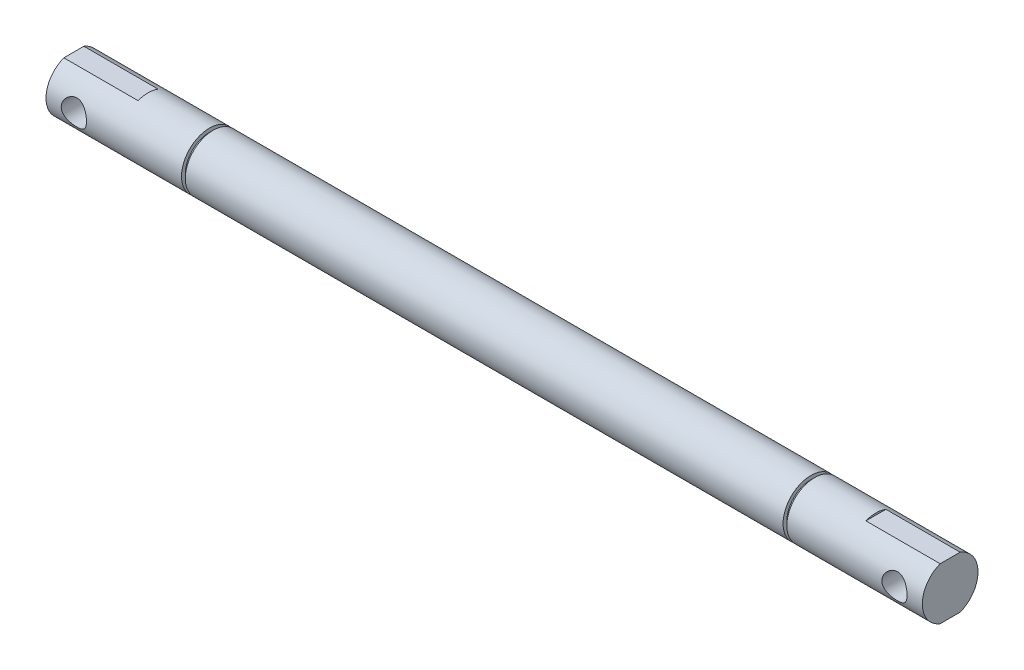
from build123d import *

# Parameters (mm, degrees)
IZIM1_R                     = 7.5
Y_KSEKLIK_EKSTR_ZYON1_DEPTH = 118
IZIM2_W                     = 1
IZIM2_H                     = 2
KES_EKSTR_ZYON1_DEPTH       = 20
M8_DI_LI_DELIK1_D           = 6.8
AYNALAMA3_COPY_1_DEPTH      = 20


with BuildPart() as part:
    # Çizim1 → Yükseklik-Ekstrüzyon1 (new, symmetric)
    with BuildSketch(Plane(origin=(0, 0, 0), x_dir=(0, 0, -1), z_dir=(1, 0, 0))):
        Circle(IZIM1_R)
    extrude(amount=Y_KSEKLIK_EKSTR_ZYON1_DEPTH, both=True)

    # Çizim2 → Kes-Döndür2 (revolve, cut)
    with BuildSketch(Plane.XY, mode=Mode.PRIVATE) as kes_d_nd_r2_sk:
        with Locations((-81, 7.5)):
            Rectangle(IZIM2_W, IZIM2_H)
    kes_d_nd_r2 = revolve(kes_d_nd_r2_sk.sketch.rotate(Axis((0, 0, 0), (-1, 0, 0)), 90), axis=Axis((0, 0, 0), (-1, 0, 0)), mode=Mode.SUBTRACT)

    # Çizim3 → Kes-Ekstrüzyon1 (cut)
    with BuildSketch(Plane.ZY.offset(118)):
        Polygon((5.217035769, 7), (-5.217035769, 7), (-0.675959806, 12.212790329), align=None)
    kes_ekstr_zyon1 = extrude(amount=-KES_EKSTR_ZYON1_DEPTH, mode=Mode.SUBTRACT)

    # Aynalama2: Kes-Ekstrüzyon1 across plane
    add(kes_ekstr_zyon1.mirror(Plane.ZX), mode=Mode.SUBTRACT)

    # M8 Dişli Delik1 (through all)
    with Locations(Plane.XY.offset(12)):
        with Locations((-110.5, 0)):
            m8_di_li_delik1 = Hole(M8_DI_LI_DELIK1_D / 2)

    # Aynalama3: Kes-Döndür2, Kes-Ekstrüzyon1, M8 Dişli Delik1 across plane
    add(kes_d_nd_r2.mirror(Plane(origin=(0, 0, 0), x_dir=(0, 0, 1), z_dir=(1, 0, 0))), mode=Mode.SUBTRACT)
    add(kes_ekstr_zyon1.mirror(Plane(origin=(0, 0, 0), x_dir=(0, 0, 1), z_dir=(1, 0, 0))), mode=Mode.SUBTRACT)
    add(m8_di_li_delik1.mirror(Plane(origin=(0, 0, 0), x_dir=(0, 0, 1), z_dir=(1, 0, 0))), mode=Mode.SUBTRACT)

    # Aynalama3 copy 1 sketch → Aynalama3 copy 1 (cut)
    with BuildSketch(Plane(origin=(118, 0, 0), x_dir=(0, 0, 1), z_dir=(1, 0, 0))):
        Polygon((5.217035769, 7), (-5.217035769, 7), (-0.675959806, 12.212790329), align=None)
    extrude(amount=-AYNALAMA3_COPY_1_DEPTH, mode=Mode.SUBTRACT)


solid = part.part
